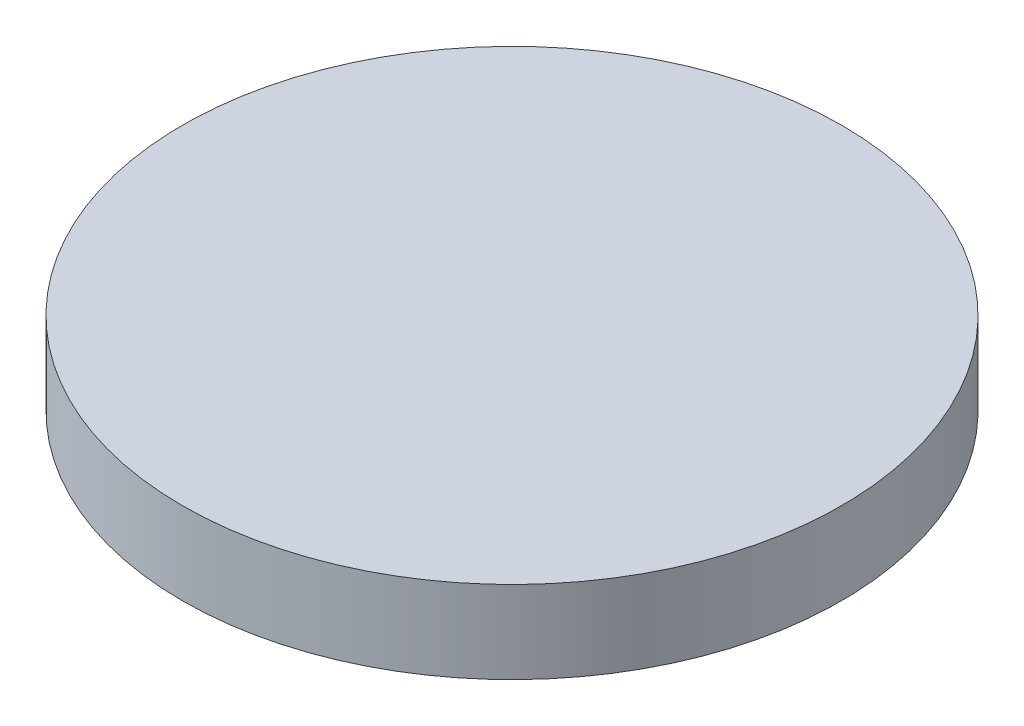
from build123d import *

# Parameters (mm, degrees)
SKETCH_1_R      = 40
EXTRUDE_1_DEPTH = 10


with BuildPart() as part:
    # 草图1 → 凸台-拉伸1 (new body)
    with BuildSketch(Plane(origin=(0, 0, 0), x_dir=(1, 0, 0), z_dir=(0, 1, 0))):
        Circle(SKETCH_1_R)
    extrude(amount=EXTRUDE_1_DEPTH)


solid = part.part
